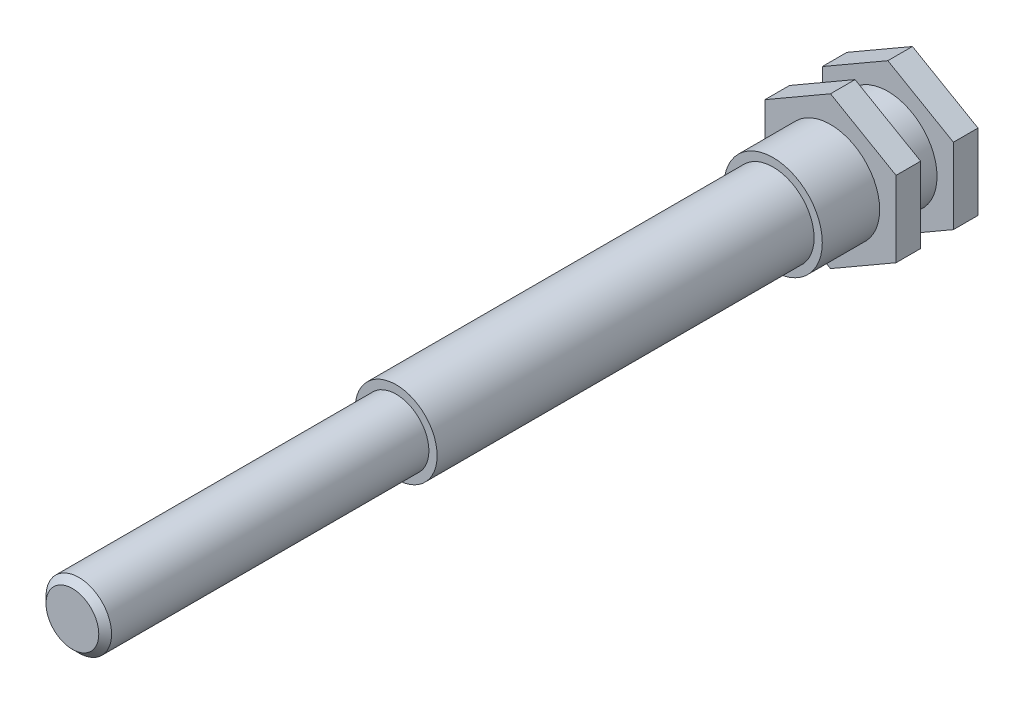
from build123d import *

# Parameters (mm, degrees)
EXTRUDE_1_DEPTH = 1.5
SKETCH_2_R      = 3
EXTRUDE_2_DEPTH = 7
EXTRUDE_START   = 3.5
EXTRUDE_3_DEPTH = 1.5
SKETCH_3_R      = 2.5
EXTRUDE_4_DEPTH = 23
SKETCH_4_R      = 2
EXTRUDE_5_DEPTH = 19.75
CHAMFER_1_SIZE  = 0.39


with BuildPart() as part:
    # Эскиз1 → Бобышка-Вытянуть1 (new body)
    with BuildSketch(Plane.XY):
        Polygon((-4, 2.309401077), (-4, -2.309401077), (0, -4.618802154), (4, -2.309401077), (4, 2.309401077), (0, 4.618802154), align=None)
    extrude(amount=EXTRUDE_1_DEPTH)

    # Эскиз2 → Бобышка-Вытянуть2 (add)
    with BuildSketch(Plane.XY.offset(1.5)):
        Circle(SKETCH_2_R)
    extrude(amount=EXTRUDE_2_DEPTH)

    # Эскиз1<2> → Бобышка-Вытянуть3 (add)
    with BuildSketch(Plane.XY.offset(EXTRUDE_START)):
        Polygon((-4, 2.309401077), (-4, -2.309401077), (0, -4.618802154), (4, -2.309401077), (4, 2.309401077), (0, 4.618802154), align=None)
    extrude(amount=EXTRUDE_3_DEPTH)

    # Эскиз3 → Бобышка-Вытянуть4 (add)
    with BuildSketch(Plane.XY.offset(8.5)):
        Circle(SKETCH_3_R)
    extrude(amount=EXTRUDE_4_DEPTH)

    # Эскиз4 → Бобышка-Вытянуть5 (add)
    with BuildSketch(Plane.XY.offset(31.5)):
        Circle(SKETCH_4_R)
    extrude(amount=EXTRUDE_5_DEPTH)

    # Фаска1
    chamfer_1_edges = [part.edges().sort_by_distance(p)[0] for p in [
        (-2, 0, 51.25),
    ]]
    chamfer(chamfer_1_edges, length=CHAMFER_1_SIZE)


solid = part.part
